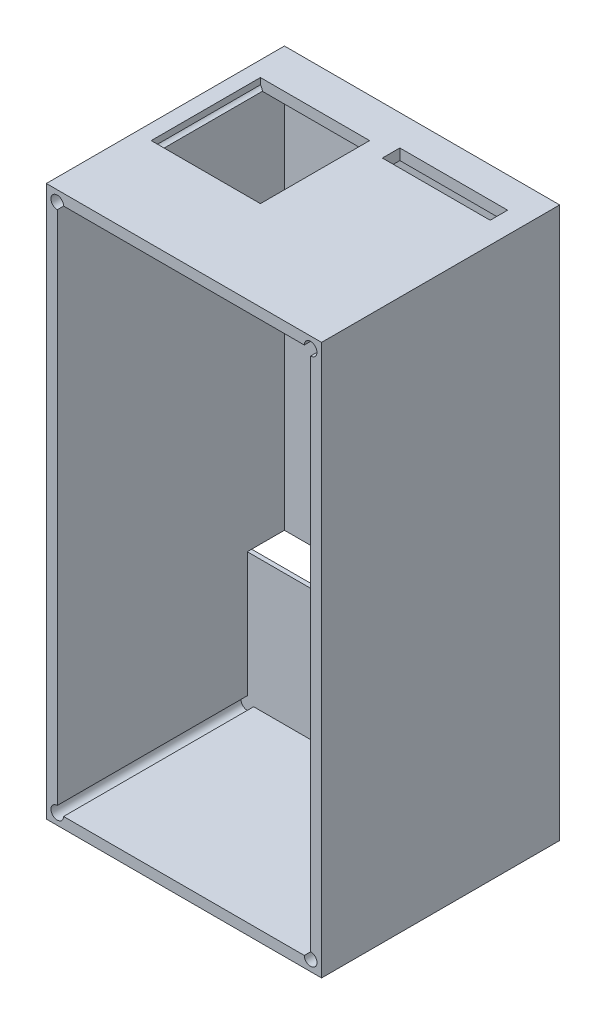
from build123d import *

# Parameters (mm, degrees)
SKETCH1_W           = 63
SKETCH1_H           = 126
BOSS_EXTRUDE1_DEPTH = 52
SKETCH2_W           = 63
SKETCH2_H           = 126
BOSS_EXTRUDE2_DEPTH = 2.5
SKETCH4_W           = 22.5
SKETCH4_H           = 32.5
CUT_EXTRUDE1_DEPTH  = 10
SKETCH5_W           = 22.5
SKETCH5_H           = 32.5
BOSS_EXTRUDE3_DEPTH = 1
SKETCH7_W           = 10
SKETCH7_H           = 32.5
BOSS_EXTRUDE6_DEPTH = 1
SKETCH8_W           = 11.6
SKETCH8_H           = 18.4
CUT_EXTRUDE2_DEPTH  = 90.058969228
SKETCH9_W           = 25
SKETCH9_H           = 25
CUT_EXTRUDE3_DEPTH  = 11
SKETCH10_W          = 24.67160759
SKETCH10_H          = 2
CUT_EXTRUDE4_DEPTH  = 11


with BuildPart() as part:
    # Sketch1 → Boss-Extrude1 (new body)
    with BuildSketch(Plane.XY):
        Rectangle(SKETCH1_W, SKETCH1_H)
        with BuildLine():
            Line((-27.55, 60.5), (27.55, 60.5))
            ThreePointArc((27.55, 60.5), (29, 61.95), (30.45, 60.5))
            ThreePointArc((30.45, 60.5), (30.025304833, 59.474695167), (29, 59.05))
            Line((29, 59.05), (29, -59.05))
            ThreePointArc((29, -59.05), (30.025304833, -59.474695167), (30.45, -60.5))
            ThreePointArc((30.45, -60.5), (29, -61.95), (27.55, -60.5))
            Line((27.55, -60.5), (-27.55, -60.5))
            ThreePointArc((-27.55, -60.5), (-30.025304833, -61.525304833), (-29, -59.05))
            Line((-29, -59.05), (-29, 59.05))
            ThreePointArc((-29, 59.05), (-30.025304833, 61.525304833), (-27.55, 60.5))
        make_face(mode=Mode.SUBTRACT)
    extrude(amount=BOSS_EXTRUDE1_DEPTH)

    # Sketch2 → Boss-Extrude2 (add)
    with BuildSketch(Plane(origin=(0, 0, 0), x_dir=(-1, 0, 0), z_dir=(0, 0, -1))):
        Rectangle(SKETCH2_W, SKETCH2_H)
    extrude(amount=BOSS_EXTRUDE2_DEPTH)

    # Sketch4 → Cut-Extrude1 (cut)
    with BuildSketch(Plane(origin=(0, 0, -2.5), x_dir=(-1, 0, 0), z_dir=(0, 0, -1))):
        with Locations((20.25, -46.75)):
            Rectangle(SKETCH4_W, SKETCH4_H)
    extrude(amount=-CUT_EXTRUDE1_DEPTH, mode=Mode.SUBTRACT)

    # Sketch5 → Boss-Extrude3 (add)
    with BuildSketch(Plane(origin=(0, 0, 7.5), x_dir=(-1, 0, 0), z_dir=(0, 0, -1))):
        with Locations((20.25, -46.75)):
            Rectangle(SKETCH5_W, SKETCH5_H)
    extrude(amount=-BOSS_EXTRUDE3_DEPTH)

    # Sketch7 → Boss-Extrude6 (add)
    with BuildSketch(Plane.ZY.offset(9)):
        with Locations((2.5, -46.75)):
            Rectangle(SKETCH7_W, SKETCH7_H)
    extrude(amount=BOSS_EXTRUDE6_DEPTH)

    # Sketch8 → Cut-Extrude2 (cut, through all)
    with BuildSketch(Plane(origin=(0, 0, -2.5), x_dir=(-1, 0, 0), z_dir=(0, 0, -1))):
        with Locations((16.2, 30)):
            Rectangle(SKETCH8_W, SKETCH8_H)
    extrude(amount=-CUT_EXTRUDE2_DEPTH, mode=Mode.SUBTRACT)

    # Sketch9 → Cut-Extrude3 (cut)
    with BuildSketch(Plane(origin=(0, 63, 0), x_dir=(1, 0, 0), z_dir=(0, 1, 0))):
        with Locations((-15.5, -19)):
            Rectangle(SKETCH9_W, SKETCH9_H)
    extrude(amount=-CUT_EXTRUDE3_DEPTH, mode=Mode.SUBTRACT)

    # Sketch10 → Cut-Extrude4 (cut)
    with BuildSketch(Plane(origin=(0, 63, 0), x_dir=(1, 0, 0), z_dir=(0, 1, 0))):
        with Locations((14.25, -7.5)):
            Rectangle(SKETCH10_W, SKETCH10_H)
        with Locations((14.25, -5.5)):
            Rectangle(SKETCH10_W, SKETCH10_H)
    extrude(amount=-CUT_EXTRUDE4_DEPTH, mode=Mode.SUBTRACT)


solid = part.part
